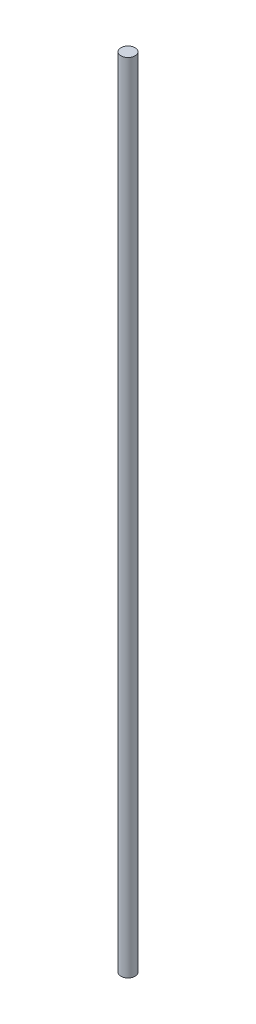
from build123d import *

# Parameters (mm, degrees)
BOSS_EXTRUDE1_DEPTH      = 170
BOSS_EXTRUDE1_DEPTH_BACK = 170
SKETCH1_R                = 3


with BuildPart() as part:
    # Sketch1 → Boss-Extrude1 (new, two sides: drawn at the far end of the back side and taken through both)
    with BuildSketch(Plane(origin=(0, 0, 0), x_dir=(1, 0, 0), z_dir=(0, 1, 0)).offset(-BOSS_EXTRUDE1_DEPTH_BACK)):
        Circle(SKETCH1_R)
    extrude(amount=BOSS_EXTRUDE1_DEPTH + BOSS_EXTRUDE1_DEPTH_BACK)


solid = part.part
